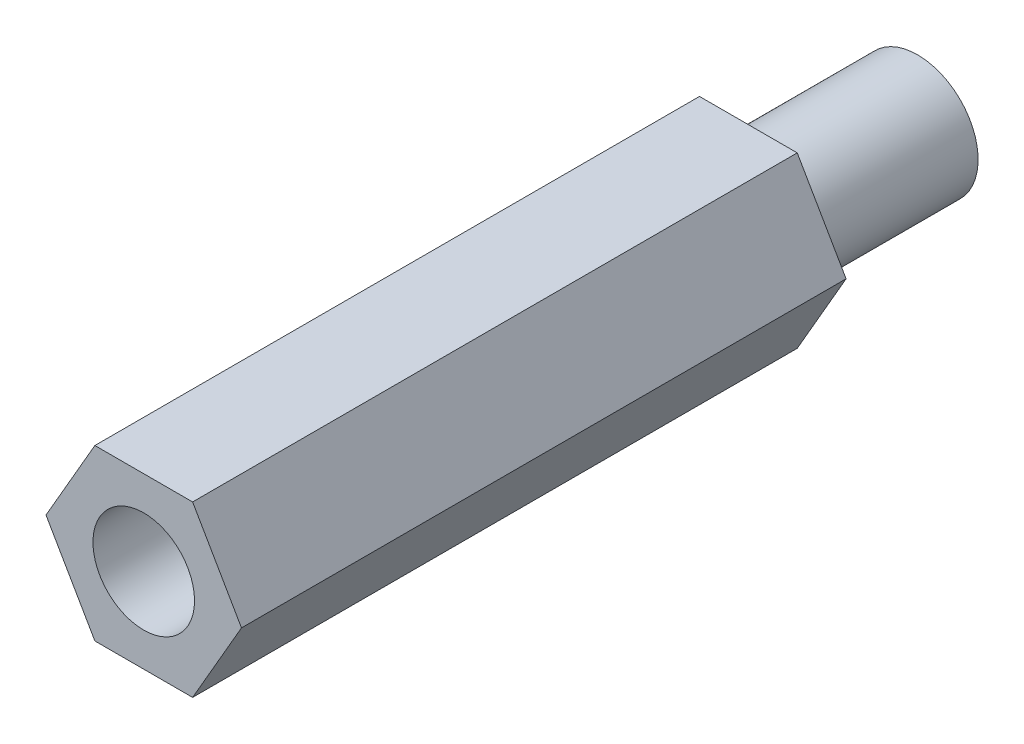
from build123d import *

# Parameters (mm, degrees)
EXTRUDE_1_DEPTH           = 25
SKETCH_4_R                = 2.5
EXTRUDE_2_DEPTH           = 7
M5X0_8_TAPPED_HOLE1_D     = 4.2
M5X0_8_TAPPED_HOLE1_DEPTH = 14
M5X0_8_TAPPED_HOLE1_TIP   = 1.2618073


with BuildPart() as part:
    # 草圖1 → 填料-伸長1 (new body)
    with BuildSketch(Plane.XY):
        Polygon((-2.020725942, 3.5), (-4.041451884, 0), (-2.020725942, -3.5), (2.020725942, -3.5), (4.041451884, 0), (2.020725942, 3.5), align=None)
    extrude(amount=EXTRUDE_1_DEPTH)

    # 草圖4 → 填料-伸長2 (add)
    with BuildSketch(Plane(origin=(0, 0, 0), x_dir=(-1, 0, 0), z_dir=(0, 0, -1))):
        Circle(SKETCH_4_R)
    extrude(amount=EXTRUDE_2_DEPTH)

    # M5x0.8 Tapped Hole1
    with Locations(Plane.XY.offset(25)):
        with Locations((0, 0)):
            Hole(M5X0_8_TAPPED_HOLE1_D / 2, depth=M5X0_8_TAPPED_HOLE1_DEPTH)
            with Locations((0, 0, -(M5X0_8_TAPPED_HOLE1_DEPTH + M5X0_8_TAPPED_HOLE1_TIP / 2))):  # 118° drill point
                Cone(0, M5X0_8_TAPPED_HOLE1_D / 2, M5X0_8_TAPPED_HOLE1_TIP, mode=Mode.SUBTRACT)


solid = part.part
